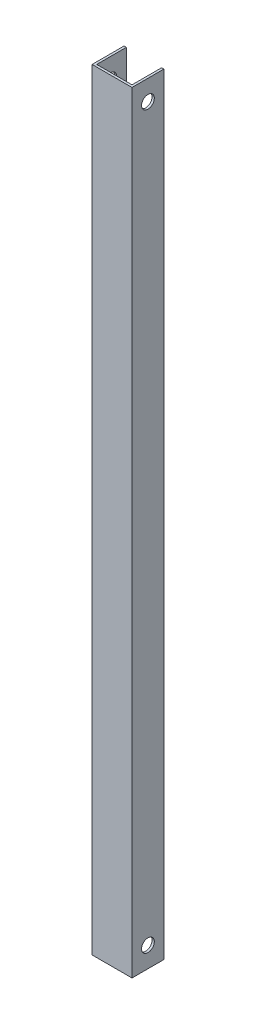
from build123d import *

# Parameters (mm, degrees)
BOSS_EXTRUDE1_DEPTH      = 145
BOSS_EXTRUDE1_DEPTH_BACK = 145
SKETCH1_W                = 15
SKETCH1_H                = 12
CUT_EXTRUDE1_DEPTH       = 200
CUT_EXTRUDE1_DEPTH_BACK  = 200
SKETCH2_W                = 13.28
SKETCH2_H                = 14
CUT_EXTRUDE2_DEPTH       = 200
CUT_EXTRUDE2_DEPTH_BACK  = 200
SKETCH3_R                = 2.4


with BuildPart() as part:
    # Sketch1 → Boss-Extrude1 (new, two sides: drawn at the far end of the back side and taken through both)
    with BuildSketch(Plane(origin=(0, 0, 0), x_dir=(1, 0, 0), z_dir=(0, 1, 0)).offset(-BOSS_EXTRUDE1_DEPTH_BACK)):
        Rectangle(SKETCH1_W, SKETCH1_H)
    extrude(amount=BOSS_EXTRUDE1_DEPTH + BOSS_EXTRUDE1_DEPTH_BACK)

    # Sketch2 → Cut-Extrude1 (cut, two sides: drawn at the far end of the back side and taken through both)
    with BuildSketch(Plane(origin=(0, 0, 0), x_dir=(1, 0, 0), z_dir=(0, 1, 0)).offset(-CUT_EXTRUDE1_DEPTH_BACK)):
        with Locations((0, 1.86)):
            Rectangle(SKETCH2_W, SKETCH2_H)
    extrude(amount=CUT_EXTRUDE1_DEPTH + CUT_EXTRUDE1_DEPTH_BACK, mode=Mode.SUBTRACT)

    # Sketch3 → Cut-Extrude2 (cut, two sides: drawn at the far end of the back side and taken through both)
    with BuildSketch(Plane(origin=(0, 0, 0), x_dir=(0, 0, -1), z_dir=(1, 0, 0)).offset(-CUT_EXTRUDE2_DEPTH_BACK)):
        with Locations((0, 137.33)):
            Circle(SKETCH3_R)
        with Locations((0, -137.33)):
            Circle(SKETCH3_R)
    extrude(amount=CUT_EXTRUDE2_DEPTH + CUT_EXTRUDE2_DEPTH_BACK, mode=Mode.SUBTRACT)


solid = part.part
